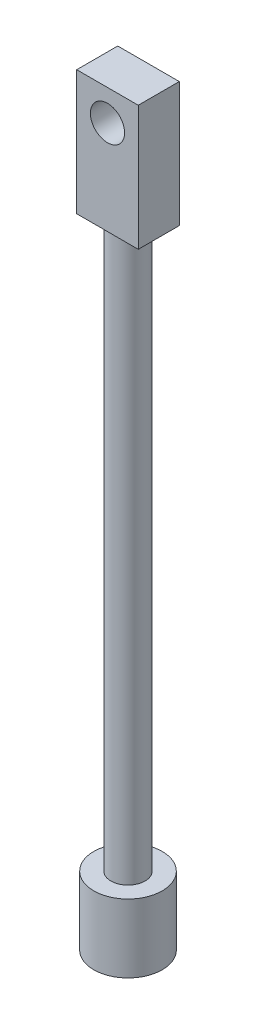
from build123d import *

# Parameters (mm, degrees)
ESQUISSE1_W        = 5
ESQUISSE1_H        = 165
ESQUISSE2_W        = 10
ESQUISSE2_H        = 20
ESQUISSE3_W        = 18
ESQUISSE3_H        = 36.5
ESQUISSE3_R        = 5
BOSS_EXTRU_1_DEPTH = 6


with BuildPart() as part:
    # Esquisse1 → Base-Révolution (revolve)
    with BuildSketch(Plane.XY, mode=Mode.PRIVATE) as base_r_volution_sk:
        with Locations((2.5, 82.5)):
            Rectangle(ESQUISSE1_W, ESQUISSE1_H)
    revolve(base_r_volution_sk.sketch.rotate(Axis((0, -40, 0), (0, 1, 0)), 90), axis=Axis((0, -40, 0), (0, 1, 0)))

    # Esquisse2 → Boss.-Révol.1 (revolve)
    with BuildSketch(Plane.XY, mode=Mode.PRIVATE) as boss_r_vol_1_sk:
        with Locations((5, -10)):
            Rectangle(ESQUISSE2_W, ESQUISSE2_H)
    revolve(boss_r_vol_1_sk.sketch.rotate(Axis((0, 0, 0), (0, -1, 0)), 90), axis=Axis((0, 0, 0), (0, -1, 0)))

    # Esquisse3 → Boss.-Extru.1 (add, symmetric)
    with BuildSketch(Plane.XY):
        with Locations((0, 183.25)):
            Rectangle(ESQUISSE3_W, ESQUISSE3_H)
        with Locations((0, 192.5)):
            Circle(ESQUISSE3_R, mode=Mode.SUBTRACT)
    extrude(amount=BOSS_EXTRU_1_DEPTH, both=True)


solid = part.part
